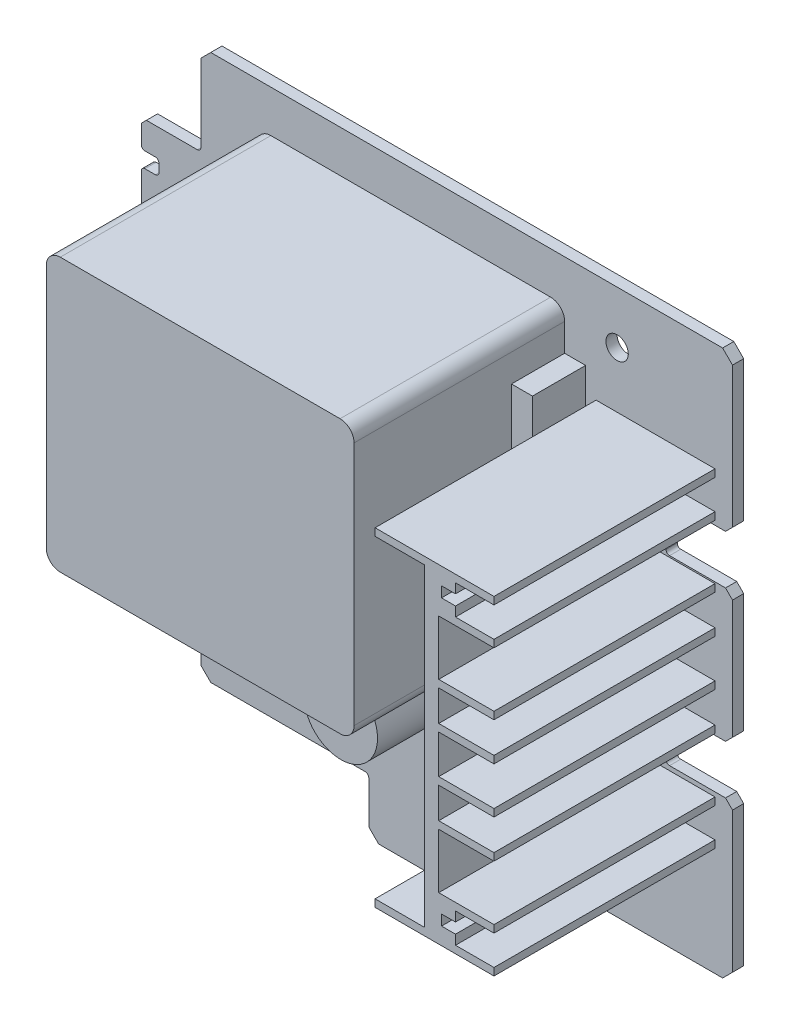
from build123d import *

# Parameters (mm, degrees)
SKETCH1_R            = 1.6
BOSS_EXTRUDE1_DEPTH  = 1.6
CHAMFER1_SIZE        = 2
CHAMFER2_SIZE        = 1
FILLET1_R            = 0.5
TRANSFORMER1_DEPTH   = 30.1
SKETCH2_3_W          = 3
SKETCH2_3_H          = 27.1
TRANSFORMER2_DEPTH   = 7.6
SKETCH3_R            = 0.5
TRANSFORMER3_DEPTH   = 2.2
TRANSFORMER3_2_DEPTH = 2.2
SKETCH2_4_R          = 5.25
CAP1_DEPTH           = 20
HEATSINK_DEPTH       = 31.6
RESISTOR_DEPTH       = 8.5
SKETCH2_7_W          = 9
SKETCH2_7_H          = 4
CAP2_DEPTH           = 7
FILLET2_R            = 2


with BuildPart() as part:
    # Sketch1 → Boss-Extrude1 (new body)
    with BuildSketch(Plane.XY):
        Polygon((-45.5, -26), (-45.5, -13.8), (-42.5, -13.8), (-42.5, -8.5), (-44.5, -8.5), (-44.5, 8.5), (-42.5, 8.5), (-42.5, 13.8), (-45.5, 13.8), (-45.5, 19.9), (-43, 19.9), (-43, 22.1), (-45.5, 22.1), (-45.5, 25.292893219), (-44.792893219, 26), (-37, 26), (-37, 37.585786438), (-35.585786438, 39), (37.585786438, 39), (39, 37.585786438), (39, 16.5), (29.5, 16.5), (29.5, 9.5), (39, 9.5), (39, -9.5), (29.5, -9.5), (29.5, -16.5), (39, -16.5), (39, -37.585786438), (37.585786438, -39), (13, -39), (13, -45.585786438), (11.585786438, -47), (-11.585786438, -47), (-13, -45.585786438), (-13, -39), (-35.585786438, -39), (-37, -37.585786438), (-37, -26), align=None)
        with Locations((-40.5, -21)):
            Circle(SKETCH1_R, mode=Mode.SUBTRACT)
        with Locations((22.5, 31.5)):
            Circle(SKETCH1_R, mode=Mode.SUBTRACT)
        with Locations((22.5, -31.5)):
            Circle(SKETCH1_R, mode=Mode.SUBTRACT)
    extrude(amount=BOSS_EXTRUDE1_DEPTH)

    # Chamfer1
    chamfer1_edges = [part.edges().sort_by_distance(p)[0] for p in [
        (-45.5, -26, 0.8),
    ]]
    chamfer(chamfer1_edges, length=CHAMFER1_SIZE)

    # Chamfer2
    chamfer2_edges = [part.edges().sort_by_distance(p)[0] for p in [
        (39, 16.5, 0.8),
        (39, 9.5, 0.8),
        (39, -16.5, 0.8),
        (39, -9.5, 0.8),
    ]]
    chamfer(chamfer2_edges, length=CHAMFER2_SIZE)

    # Fillet1
    fillet1_edges = [part.edges().sort_by_distance(p)[0] for p in [
        (-45.5, 19.9, 0.8),
        (-45.5, 22.1, 0.8),
        (-45.5, 13.8, 0.8),
        (-44.5, 8.5, 0.8),
        (-45.5, -13.8, 0.8),
        (-44.5, -8.5, 0.8),
        (-37, 26, 0.8),
        (29.5, 16.5, 0.8),
        (29.5, 9.5, 0.8),
        (29.5, -9.5, 0.8),
        (29.5, -16.5, 0.8),
        (13, -39, 0.8),
        (-13, -39, 0.8),
        (-37, -26, 0.8),
        (-43, 19.9, 0.8),
        (-43, 22.1, 0.8),
        (-42.5, 13.8, 0.8),
        (-42.5, 8.5, 0.8),
        (-42.5, -13.8, 0.8),
        (-42.5, -8.5, 0.8),
    ]]
    fillet(fillet1_edges, radius=FILLET1_R)


with BuildPart() as body_2:
    # Sketch2 → transformer1 (new body)
    with BuildSketch(Plane.XY.offset(1.6)):
        Polygon((15, -0.05), (15, 27.05), (15, 33), (-29, 33), (-29, -6), (10.5, -6), (15, -6), align=None)
    extrude(amount=TRANSFORMER1_DEPTH)

    # Sketch2<3> → transformer2 (add)
    with BuildSketch(Plane.XY.offset(1.6)):
        with Locations((16.5, 13.5)):
            Rectangle(SKETCH2_3_W, SKETCH2_3_H)
    extrude(amount=TRANSFORMER2_DEPTH)

    # Fillet2
    fillet2_edges = [body_2.edges().sort_by_distance(p)[0] for p in [
        (-29, 33, 16.65),
        (15, 33, 16.65),
        (15, -6, 16.65),
        (-29, -6, 16.65),
    ]]
    fillet(fillet2_edges, radius=FILLET2_R)


with BuildPart() as body_3:
    # Sketch3 → transformer3 (new body)
    with BuildSketch(Plane(origin=(0, 0, 0), x_dir=(-1, 0, 0), z_dir=(0, 0, -1))):
        with Locations((18.75, 14.5)):
            Circle(SKETCH3_R)
    extrude(amount=TRANSFORMER3_DEPTH)


with BuildPart() as body_4:
    # Sketch3 → transformer3 2 (new body)
    with BuildSketch(Plane(origin=(0, 0, 0), x_dir=(-1, 0, 0), z_dir=(0, 0, -1))):
        with Locations((18.75, 23.25)):
            Circle(SKETCH3_R)
    extrude(amount=TRANSFORMER3_2_DEPTH)


with BuildPart() as body_5:
    # Sketch2<4> → cap1 (new body)
    with BuildSketch(Plane.XY.offset(1.6)):
        with Locations((3, -14)):
            Circle(SKETCH2_4_R)
    extrude(amount=CAP1_DEPTH)


with BuildPart() as body_6:
    # Sketch2<5> → heatsink (new body)
    with BuildSketch(Plane.XY.offset(1.6)):
        Polygon((28.6, 17.13), (36.5, 17.13), (36.5, 18.19), (31, 18.19), (31, 19.565), (29, 19.565), (29, 21.065), (31, 21.065), (31, 22.44), (36.5, 22.44), (36.5, 23.5), (19.5, 23.5), (19.5, 22.44), (26.6, 22.44), (26.6, -22.44), (19.5, -22.44), (19.5, -23.5), (36.5, -23.5), (36.5, -22.44), (31, -22.44), (31, -21.065), (29, -21.065), (29, -19.565), (31, -19.565), (31, -18.19), (36.5, -18.19), (36.5, -17.13), (28.6, -17.13), (28.6, -9.28), (36.5, -9.28), (36.5, -8.22), (28.6, -8.22), (28.6, -3.82), (36.5, -3.82), (36.5, -2.76), (28.6, -2.76), (28.6, 2.76), (36.5, 2.76), (36.5, 3.82), (28.6, 3.82), (28.6, 8.22), (36.5, 8.22), (36.5, 9.28), (28.6, 9.28), align=None)
    extrude(amount=HEATSINK_DEPTH)


with BuildPart() as body_7:
    # Sketch2<6> → resistor (new body)
    with BuildSketch(Plane.XY.offset(1.6)):
        Polygon((15.5, -6), (15, -6), (10.5, -6), (10.5, -20), (15.5, -20), align=None)
    extrude(amount=RESISTOR_DEPTH)


with BuildPart() as body_8:
    # Sketch2<7> → cap2 (new body)
    with BuildSketch(Plane.XY.offset(1.6)):
        with Locations((7, -24.5)):
            Rectangle(SKETCH2_7_W, SKETCH2_7_H)
    extrude(amount=CAP2_DEPTH)


solid = Compound([part.part, body_2.part, body_3.part, body_4.part, body_5.part, body_6.part, body_7.part, body_8.part])
